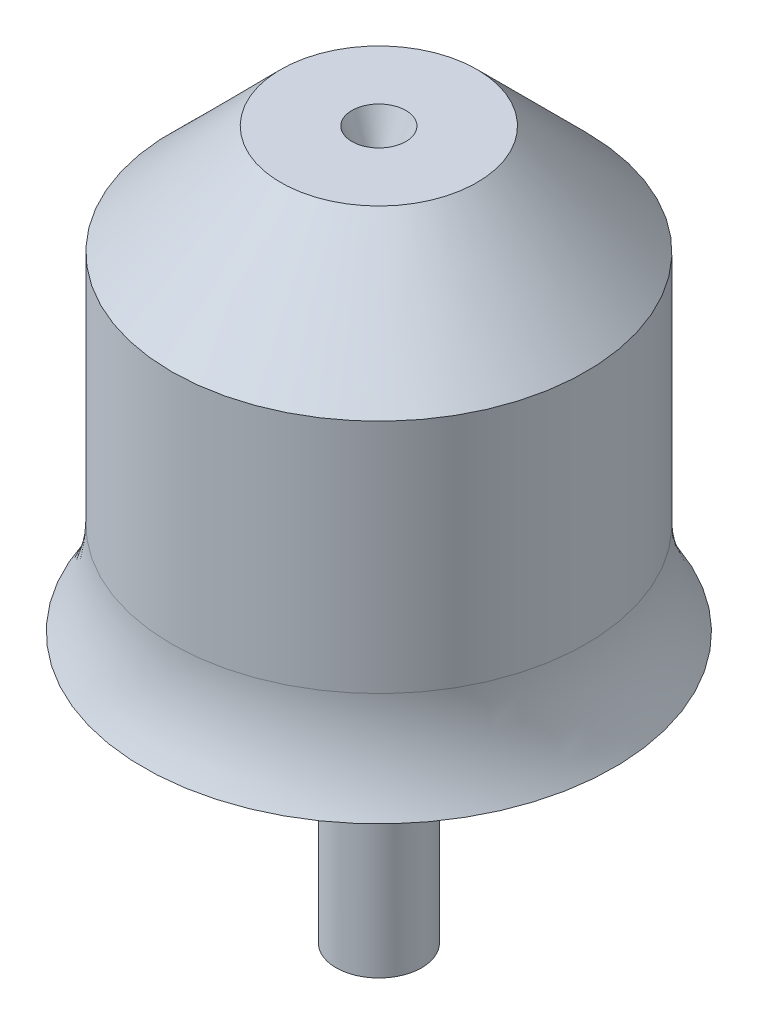
from build123d import *

# Parameters (mm, degrees)
SKETCH2_R           = 6.35
BOSS_EXTRUDE1_DEPTH = 40
FILLET1_R           = 10
SKETCH5_R           = 4


with BuildPart() as part:
    # Sketch2 → Boss-Extrude1 (new body)
    with BuildSketch(Plane(origin=(0, 0, 0), x_dir=(1, 0, 0), z_dir=(0, 1, 0))):
        with Locations(Location((0, 0, 0), (0, 0, 270))):
            Circle(SKETCH2_R)
    extrude(amount=BOSS_EXTRUDE1_DEPTH)

    # Sketch4 → Revolve1 (revolve)
    with BuildSketch(Plane.XY, mode=Mode.PRIVATE) as revolve1_sk:
        with BuildLine():
            Line((0, 40), (34.903897247, 40))
            ThreePointArc((34.903897247, 40), (31.810988232, 46.594188763), (30.75, 53.8))
            Line((30.75, 53.8), (30.75, 88.8))
            Line((30.75, 88.8), (14.55, 105))
            Line((14.55, 105), (0, 105))
            Line((0, 105), (0, 40))
        make_face()
    revolve(revolve1_sk.sketch.rotate(Axis((0, 40, 0), (0, 1, 0)), 90), axis=Axis((0, 40, 0), (0, 1, 0)))

    # Fillet1
    fillet1_edges = [part.edges().sort_by_distance(p)[0] for p in [
        (0, 40, -6.35),
    ]]
    fillet(fillet1_edges, radius=FILLET1_R)

    # Sketch5 → Cut-Loft1 section 0
    with BuildSketch(Plane(origin=(0, 105, 0), x_dir=(1, 0, 0), z_dir=(0, 1, 0)), mode=Mode.PRIVATE) as cut_loft1_s0:
        Circle(SKETCH5_R)
    loft([Vertex(0, 95, 0), cut_loft1_s0.sketch], mode=Mode.SUBTRACT)


solid = part.part
